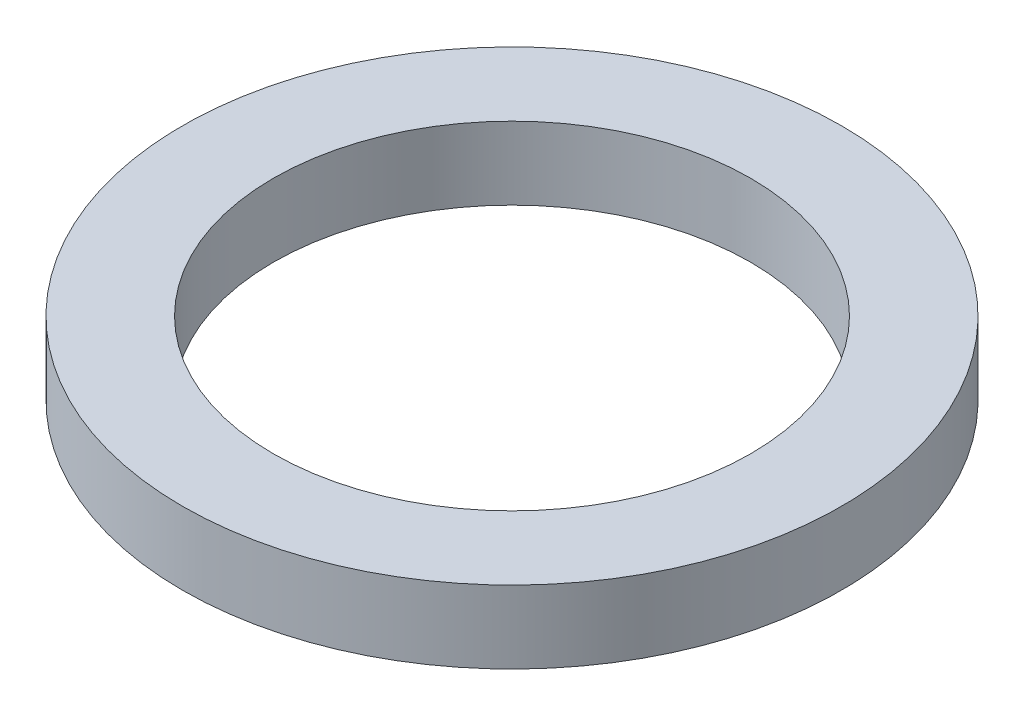
from build123d import *

# Parameters (mm, degrees)
SKETCH1_R           = 11.509375
SKETCH1_R_2         = 8.334375
BOSS_EXTRUDE1_DEPTH = 2.54


with BuildPart() as part:
    # Sketch1 → Boss-Extrude1 (new body)
    with BuildSketch(Plane(origin=(0, 0, 0), x_dir=(1, 0, 0), z_dir=(0, 1, 0))):
        with Locations(Location((0, 0, 0), (0, 0, 270))):
            Circle(SKETCH1_R)
        with Locations(Location((0, 0, 0), (0, 0, 270))):
            Circle(SKETCH1_R_2, mode=Mode.SUBTRACT)
    extrude(amount=BOSS_EXTRUDE1_DEPTH)


solid = part.part
